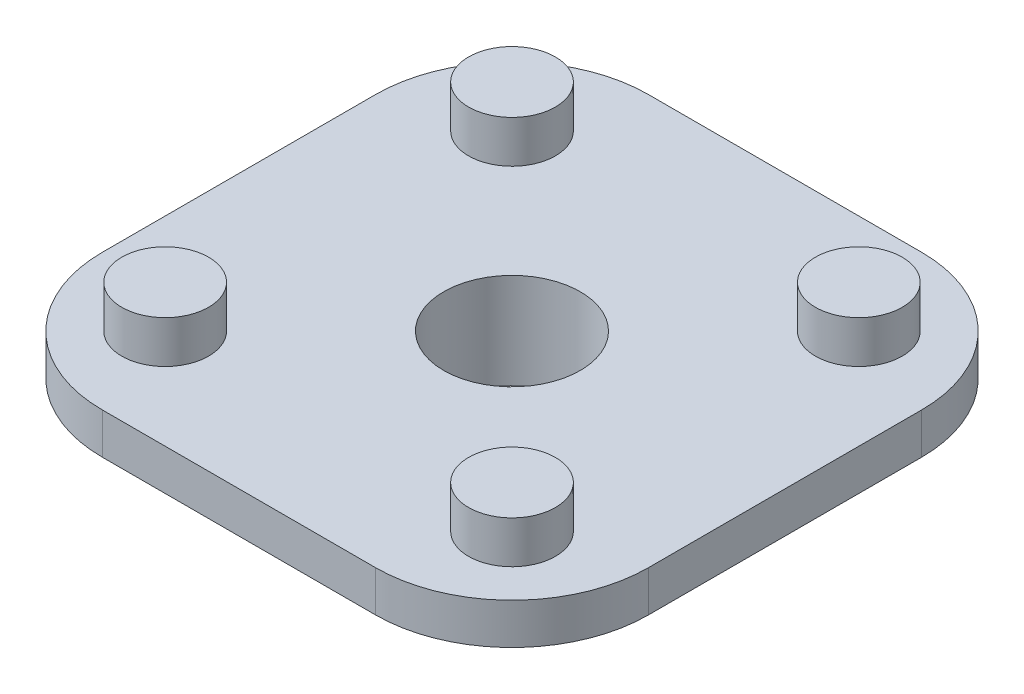
from build123d import *

# Parameters (mm, degrees)
EXTRUDE_1_DEPTH     = 3
SKETCH_2_R          = 3.18
EXTRUDE_2_DEPTH     = 3.1
SKETCH_3_R          = 5
CUT_EXTRUDE_1_DEPTH = 3.1
SKETCH_4_R          = 7.5
SKETCH_4_R_2        = 5
EXTRUDE_3_DEPTH     = 4


with BuildPart() as part:
    # 草图1 → 凸台-拉伸1 (new body)
    with BuildSketch(Plane(origin=(0, 0, 0), x_dir=(1, 0, 0), z_dir=(0, 1, 0))):
        with BuildLine():
            Line((-10, 20), (10, 20))
            ThreePointArc((10, 20), (17.071067812, 17.071067812), (20, 10))
            Line((20, 10), (20, -10))
            ThreePointArc((20, -10), (17.071067812, -17.071067812), (10, -20))
            Line((10, -20), (-10, -20))
            ThreePointArc((-10, -20), (-17.071067812, -17.071067812), (-20, -10))
            Line((-20, -10), (-20, 10))
            ThreePointArc((-20, 10), (-17.071067812, 17.071067812), (-10, 20))
        make_face()
    extrude(amount=EXTRUDE_1_DEPTH)

    # 草图2 → 凸台-拉伸2 (add)
    with BuildSketch(Plane(origin=(0, 3, 0), x_dir=(1, 0, 0), z_dir=(0, 1, 0))):
        with Locations(Location((12.7, 12.7, 0), (0, 0, 90))):
            Circle(SKETCH_2_R)
        with Locations(Location((12.7, -12.7, 0), (0, 0, 90))):
            Circle(SKETCH_2_R)
        with Locations(Location((-12.7, -12.7, 0), (0, 0, 90))):
            Circle(SKETCH_2_R)
        with Locations(Location((-12.7, 12.7, 0), (0, 0, 90))):
            Circle(SKETCH_2_R)
    extrude(amount=EXTRUDE_2_DEPTH)

    # 草图3 → 切除-拉伸1 (cut)
    with BuildSketch(Plane(origin=(0, 3, 0), x_dir=(1, 0, 0), z_dir=(0, 1, 0))):
        with Locations(Location((0, 0, 0), (0, 0, 270))):
            Circle(SKETCH_3_R)
    extrude(amount=-CUT_EXTRUDE_1_DEPTH, mode=Mode.SUBTRACT)

    # 草图4 → 凸台-拉伸3 (add)
    with BuildSketch(Plane.XZ):
        with Locations(Location((0, 0, 0), (0, 0, 90))):
            Circle(SKETCH_4_R)
        with Locations(Location((0, 0, 0), (0, 0, 90))):
            Circle(SKETCH_4_R_2, mode=Mode.SUBTRACT)
    extrude(amount=EXTRUDE_3_DEPTH)


solid = part.part
